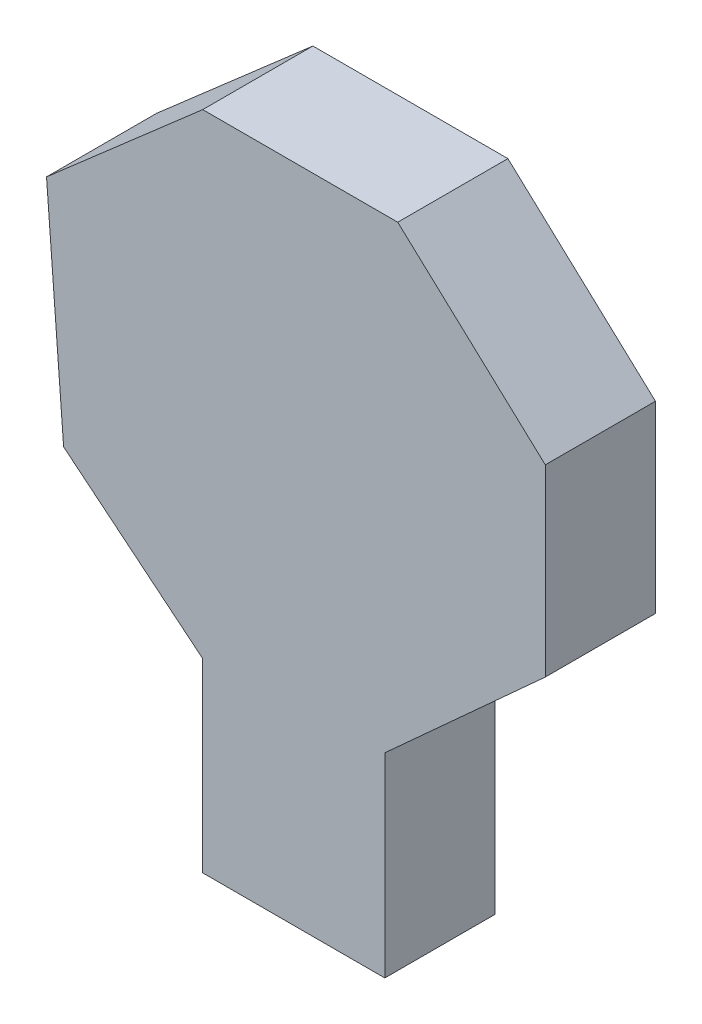
from build123d import *

# Parameters (mm, degrees)
EXTRUDE_1_DEPTH = 10


with BuildPart() as part:
    # 草图1 → 凸台-拉伸1 (new body)
    with BuildSketch(Plane.XY):
        Polygon((-8.420365535, -0.861618799), (-8.420365535, -17.702349869), (8.107049608, -17.702349869), (8.107049608, 0), (22.676240209, 13.237597911), (22.676240209, 29.921671018), (9.281984334, 42.297650131), (-8.420365535, 42.297650131), (-22.597911227, 29.921671018), (-21.046413588, 9.473877695), align=None)
    extrude(amount=EXTRUDE_1_DEPTH)


solid = part.part
